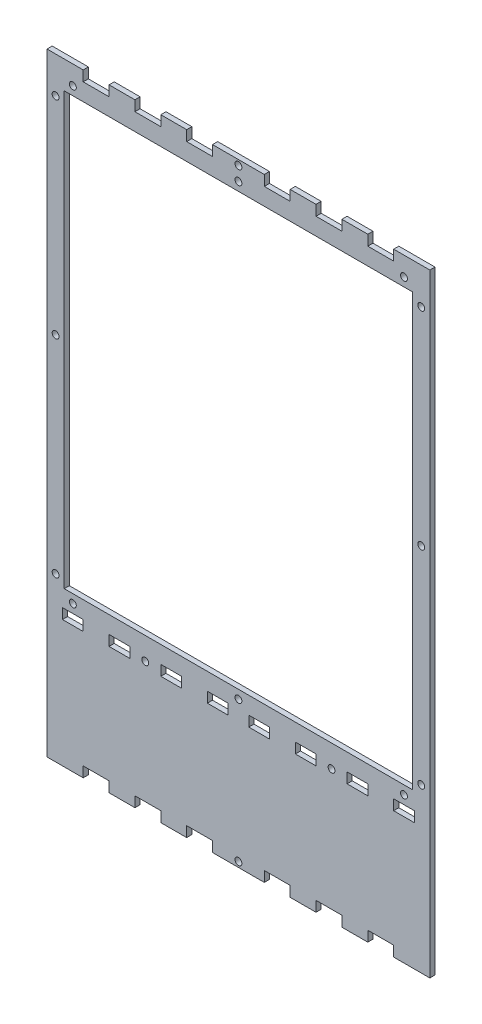
from build123d import *

# Parameters (mm, degrees)
ESQUISSE1_W             = 222
ESQUISSE1_H             = 355.5
BOSS_EXTRU_1_DEPTH      = 3
ESQUISSE2_R             = 2
ESQUISSE2_W             = 15
ESQUISSE2_H             = 6
ENL_V_MAT_EXTRU_1_DEPTH = 3
ESQUISSE3_R             = 2
ESQUISSE3_W             = 12
ESQUISSE3_H             = 6
ENL_V_MAT_EXTRU_2_DEPTH = 3
ESQUISSE4_R             = 2
ESQUISSE4_W             = 202
ESQUISSE4_H             = 250
ENL_V_MAT_EXTRU_3_DEPTH = 3


with BuildPart() as part:
    # Esquisse1 → Boss.-Extru.1 (new body)
    with BuildSketch(Plane.XY):
        with Locations((61.472433281, -103.842323651)):
            Rectangle(ESQUISSE1_W, ESQUISSE1_H)
    extrude(amount=BOSS_EXTRU_1_DEPTH)

    # Esquisse2 → Enlèv. mat.-Extru.1 (cut)
    with BuildSketch(Plane.XY.offset(3)):
        with Locations((61.472433281, 70.907676349)):
            Circle(ESQUISSE2_R)
        with Locations(Location((61.472433281, -278.592323651, 0), (0, 0, 180))):
            Circle(ESQUISSE2_R)
        with Locations((8.972433281, 70.907676349)):
            Rectangle(ESQUISSE2_W, ESQUISSE2_H)
        with Locations((83.972433281, 70.907676349)):
            Rectangle(ESQUISSE2_W, ESQUISSE2_H)
        with Locations((143.972433281, 70.907676349)):
            Rectangle(ESQUISSE2_W, ESQUISSE2_H)
        with Locations((113.972433281, 70.907676349)):
            Rectangle(ESQUISSE2_W, ESQUISSE2_H)
        with Locations((-21.027566719, 70.907676349)):
            Rectangle(ESQUISSE2_W, ESQUISSE2_H)
        with Locations((38.972433281, 70.907676349)):
            Rectangle(ESQUISSE2_W, ESQUISSE2_H)
        with Locations((38.972433281, -278.592323651)):
            Rectangle(ESQUISSE2_W, ESQUISSE2_H)
        with Locations((-21.027566719, -278.592323651)):
            Rectangle(ESQUISSE2_W, ESQUISSE2_H)
        with Locations((8.972433281, -278.592323651)):
            Rectangle(ESQUISSE2_W, ESQUISSE2_H)
        with Locations((113.972433281, -278.592323651)):
            Rectangle(ESQUISSE2_W, ESQUISSE2_H)
        with Locations((143.972433281, -278.592323651)):
            Rectangle(ESQUISSE2_W, ESQUISSE2_H)
        with Locations((83.972433281, -278.592323651)):
            Rectangle(ESQUISSE2_W, ESQUISSE2_H)
    extrude(amount=-ENL_V_MAT_EXTRU_1_DEPTH, mode=Mode.SUBTRACT)

    # Esquisse3 → Enlèv. mat.-Extru.2 (cut)
    with BuildSketch(Plane.XY.offset(3)):
        with Locations((7.472433281, -205.092323651)):
            Circle(ESQUISSE3_R)
        with Locations(Location((115.472433281, -205.092323651, 0), (0, 0, 180))):
            Circle(ESQUISSE3_R)
        with Locations((49.472433281, -205.092323651)):
            Rectangle(ESQUISSE3_W, ESQUISSE3_H)
        with Locations((22.472433281, -205.092323651)):
            Rectangle(ESQUISSE3_W, ESQUISSE3_H)
        with Locations((-7.527566719, -205.092323651)):
            Rectangle(ESQUISSE3_W, ESQUISSE3_H)
        with Locations((-34.527566719, -205.092323651)):
            Rectangle(ESQUISSE3_W, ESQUISSE3_H)
        with Locations((157.472433281, -205.092323651)):
            Rectangle(ESQUISSE3_W, ESQUISSE3_H)
        with Locations((130.472433281, -205.092323651)):
            Rectangle(ESQUISSE3_W, ESQUISSE3_H)
        with Locations((100.472433281, -205.092323651)):
            Rectangle(ESQUISSE3_W, ESQUISSE3_H)
        with Locations((73.472433281, -205.092323651)):
            Rectangle(ESQUISSE3_W, ESQUISSE3_H)
    extrude(amount=-ENL_V_MAT_EXTRU_2_DEPTH, mode=Mode.SUBTRACT)

    # Esquisse4 → Enlèv. mat.-Extru.3 (cut)
    with BuildSketch(Plane.XY.offset(3)):
        with Locations((-44.527566719, -187.092323651)):
            Circle(ESQUISSE4_R)
        with Locations((-34.527566719, -197.092323651)):
            Circle(ESQUISSE4_R)
        with Locations(Location((157.472433281, -197.092323651, 0), (0, 0, 180))):
            Circle(ESQUISSE4_R)
        with Locations(Location((167.472433281, -187.092323651, 0), (0, 0, 180))):
            Circle(ESQUISSE4_R)
        with Locations((167.472433281, 52.907676349)):
            Circle(ESQUISSE4_R)
        with Locations((157.472433281, 62.907676349)):
            Circle(ESQUISSE4_R)
        with Locations(Location((-34.527566719, 62.907676349, 0), (0, 0, 180))):
            Circle(ESQUISSE4_R)
        with Locations(Location((-44.527566719, 52.907676349, 0), (0, 0, 180))):
            Circle(ESQUISSE4_R)
        with Locations((-44.527566719, -67.092323651)):
            Circle(ESQUISSE4_R)
        with Locations((167.472433281, -67.092323651)):
            Circle(ESQUISSE4_R)
        with Locations((61.472433281, 62.907676349)):
            Circle(ESQUISSE4_R)
        with Locations((61.472433281, -197.092323651)):
            Circle(ESQUISSE4_R)
        with Locations((61.472433281, -67.092323651)):
            Rectangle(ESQUISSE4_W, ESQUISSE4_H)
    extrude(amount=-ENL_V_MAT_EXTRU_3_DEPTH, mode=Mode.SUBTRACT)


solid = part.part
